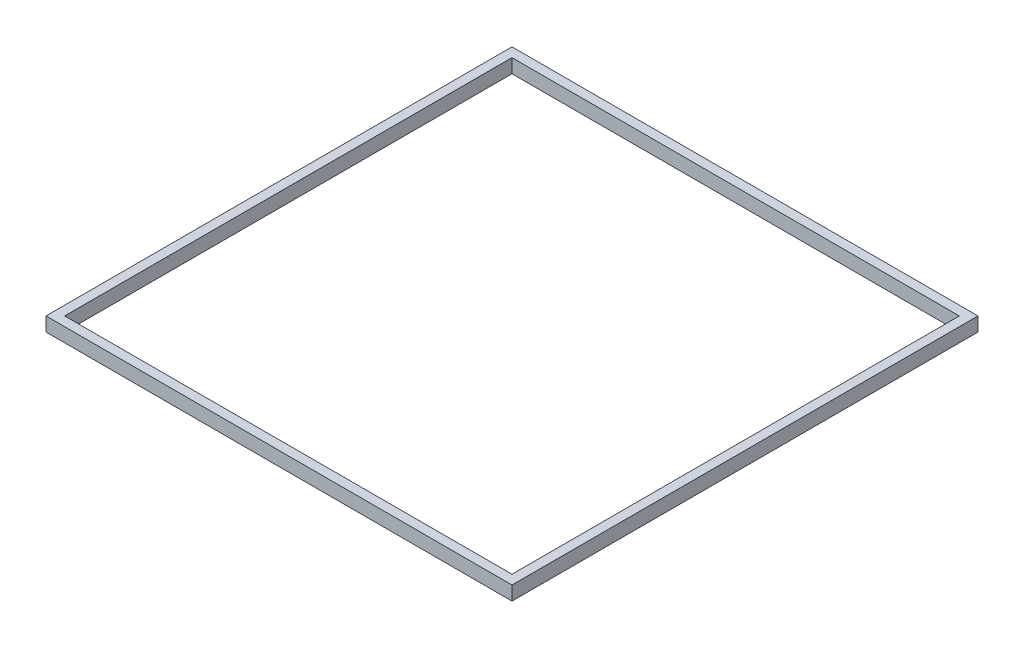
from build123d import *

# Parameters (mm, degrees)
SKETCH1_W           = 250
SKETCH1_H           = 250
SKETCH1_W_2         = 240
SKETCH1_H_2         = 240
BOSS_EXTRUDE1_DEPTH = 7.5


with BuildPart() as part:
    # Sketch1 → Boss-Extrude1 (new body)
    with BuildSketch(Plane(origin=(0, 0, 0), x_dir=(1, 0, 0), z_dir=(0, 1, 0))):
        Rectangle(SKETCH1_W, SKETCH1_H)
        Rectangle(SKETCH1_W_2, SKETCH1_H_2, mode=Mode.SUBTRACT)
    extrude(amount=BOSS_EXTRUDE1_DEPTH)


solid = part.part
